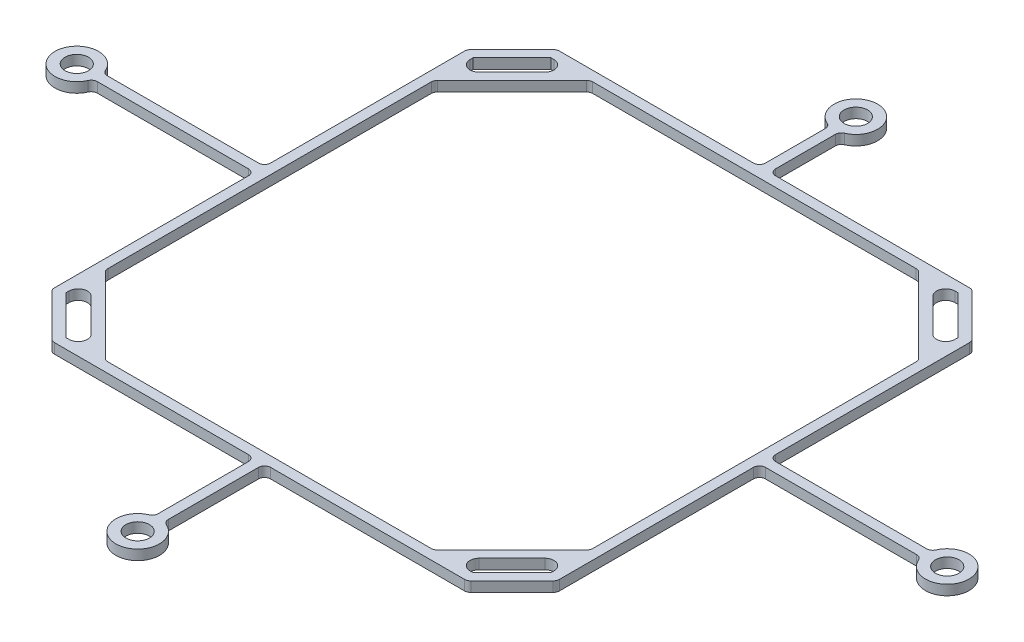
from build123d import *

# Parameters (mm, degrees)
SKETCH1_R           = 1.925
BOSS_EXTRUDE1_DEPTH = 1.65
FILLET4_R           = 1
FILLET3_R           = 1.5
FILLET5_R           = 1


with BuildPart() as part:
    # Sketch1 → Boss-Extrude1 (new body)
    with BuildSketch(Plane(origin=(0, 0, 0), x_dir=(1, 0, 0), z_dir=(0, 1, 0))):
        with BuildLine():
            Line((-41.448800006, 34.091704203), (-34.091704203, 41.448800006))
            Line((-34.091704203, 41.448800006), (-0.825, 41.448800006))
            Line((-0.825, 41.448800006), (-0.825, 52.97029458))
            ThreePointArc((-0.825, 52.97029458), (0, 60.023800006), (0.825, 52.97029458))
            Line((0.825, 52.97029458), (0.825, 41.448800006))
            Line((0.825, 41.448800006), (34.091704203, 41.448800006))
            Line((34.091704203, 41.448800006), (41.448800006, 34.091704203))
            Line((41.448800006, 34.091704203), (41.448800006, 0.825))
            Line((41.448800006, 0.825), (67.97029458, 0.825))
            ThreePointArc((67.97029458, 0.825), (75.023800006, 0), (67.97029458, -0.825))
            Line((67.97029458, -0.825), (41.448800006, -0.825))
            Line((41.448800006, -0.825), (41.448800006, -34.091704203))
            Line((41.448800006, -34.091704203), (34.091704203, -41.448800006))
            Line((34.091704203, -41.448800006), (0.825, -41.448800006))
            Line((0.825, -41.448800006), (0.825, -57.97029458))
            ThreePointArc((0.825, -57.97029458), (0, -65.023800006), (-0.825, -57.97029458))
            Line((-0.825, -57.97029458), (-0.825, -41.448800006))
            Line((-0.825, -41.448800006), (-34.091704203, -41.448800006))
            Line((-34.091704203, -41.448800006), (-41.448800006, -34.091704203))
            Line((-41.448800006, -34.091704203), (-41.448800006, -0.825))
            Line((-41.448800006, -0.825), (-67.97029458, -0.825))
            ThreePointArc((-67.97029458, -0.825), (-75.023800006, 0), (-67.97029458, 0.825))
            Line((-67.97029458, 0.825), (-41.448800006, 0.825))
            Line((-41.448800006, 0.825), (-41.448800006, 34.091704203))
        make_face()
        with Locations(Location((0, 56.448800006, 0), (0, 0, 270))):
            Circle(SKETCH1_R, mode=Mode.SUBTRACT)
        with Locations(Location((71.448800006, 0, 0), (0, 0, 90))):
            Circle(SKETCH1_R, mode=Mode.SUBTRACT)
        with Locations(Location((0, -61.448800006, 0), (0, 0, 270))):
            Circle(SKETCH1_R, mode=Mode.SUBTRACT)
        with Locations(Location((-71.448800006, 0, 0), (0, 0, 270))):
            Circle(SKETCH1_R, mode=Mode.SUBTRACT)
        Polygon((-39.798800006, 33.408251825), (-33.408251825, 39.798800006), (-29.292890359, 39.798800006), (-39.798800006, 29.292890359), align=None, mode=Mode.SUBTRACT)
        Polygon((-33.408251825, -39.798800006), (-29.292890359, -39.798800006), (-39.798800006, -29.292890359), (-39.798800006, -33.408251825), align=None, mode=Mode.SUBTRACT)
        Polygon((39.798800006, -33.408251825), (39.798800006, -29.292890359), (29.292890359, -39.798800006), (33.408251825, -39.798800006), align=None, mode=Mode.SUBTRACT)
        Polygon((33.408251825, 39.798800006), (39.798800006, 33.408251825), (39.798800006, 29.292890359), (29.292890359, 39.798800006), align=None, mode=Mode.SUBTRACT)
        Polygon((-39.798800006, 26.959437981), (-26.959437981, 39.798800006), (26.959437981, 39.798800006), (39.798800006, 26.959437981), (39.798800006, -26.959437981), (26.959437981, -39.798800006), (-26.959437981, -39.798800006), (-39.798800006, -26.959437981), align=None, mode=Mode.SUBTRACT)
    extrude(amount=BOSS_EXTRUDE1_DEPTH)

    # Fillet4
    fillet4_edges = [part.edges().sort_by_distance(p)[0] for p in [
        (-0.825, 0.825, -41.448800006),
        (-0.825, 0.825, -52.97029458),
        (0.825, 0.825, -52.97029458),
        (0.825, 0.825, -41.448800006),
        (41.448800006, 0.825, -0.825),
        (67.97029458, 0.825, -0.825),
        (67.97029458, 0.825, 0.825),
        (41.448800006, 0.825, 0.825),
        (0.825, 0.825, 41.448800006),
        (0.825, 0.825, 57.97029458),
        (-0.825, 0.825, 57.97029458),
        (-0.825, 0.825, 41.448800006),
        (-41.448800006, 0.825, 0.825),
        (-67.97029458, 0.825, 0.825),
        (-67.97029458, 0.825, -0.825),
        (-41.448800006, 0.825, -0.825),
    ]]
    fillet(fillet4_edges, radius=FILLET4_R)

    # Fillet3
    fillet3_edges = [part.edges().sort_by_distance(p)[0] for p in [
        (-29.292890359, 0.825, 39.798800006),
        (-39.798800006, 0.825, 29.292890359),
        (-39.798800006, 0.825, -29.292890359),
        (-29.292890359, 0.825, -39.798800006),
        (29.292890359, 0.825, -39.798800006),
        (39.798800006, 0.825, -29.292890359),
        (39.798800006, 0.825, 29.292890359),
        (29.292890359, 0.825, 39.798800006),
    ]]
    fillet(fillet3_edges, radius=FILLET3_R)

    # Fillet5
    fillet5_edges = [part.edges().sort_by_distance(p)[0] for p in [
        (-39.798800006, 0.825, -26.959437981),
        (-39.798800006, 0.825, 26.959437981),
        (-26.959437981, 0.825, 39.798800006),
        (26.959437981, 0.825, 39.798800006),
        (39.798800006, 0.825, 26.959437981),
        (39.798800006, 0.825, -26.959437981),
        (26.959437981, 0.825, -39.798800006),
        (-26.959437981, 0.825, -39.798800006),
        (-41.448800006, 0.825, -34.091704203),
        (-34.091704203, 0.825, -41.448800006),
        (34.091704203, 0.825, -41.448800006),
        (41.448800006, 0.825, -34.091704203),
        (41.448800006, 0.825, 34.091704203),
        (34.091704203, 0.825, 41.448800006),
        (-34.091704203, 0.825, 41.448800006),
        (-41.448800006, 0.825, 34.091704203),
    ]]
    fillet(fillet5_edges, radius=FILLET5_R)


solid = part.part
